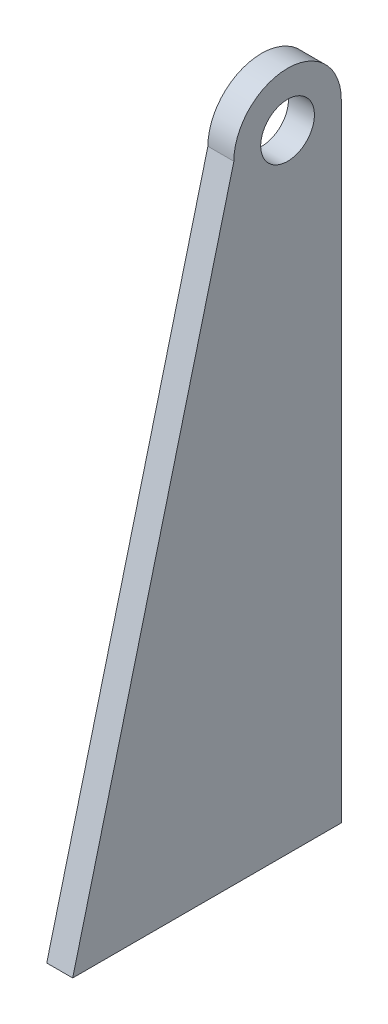
from build123d import *

# Parameters (mm, degrees)
SKETCH1_R           = 6
BOSS_EXTRUDE1_DEPTH = 5.8


with BuildPart() as part:
    # Sketch1 → Boss-Extrude1 (new body)
    with BuildSketch(Plane(origin=(0, 0, 0), x_dir=(0, 0, -1), z_dir=(1, 0, 0))):
        with BuildLine():
            Line((0, 0), (60, 0))
            Line((60, 0), (60, 140))
            ThreePointArc((60, 140), (48, 152), (36, 140))
            Line((36, 140), (0, 0))
        make_face()
        with Locations((48, 140)):
            Circle(SKETCH1_R, mode=Mode.SUBTRACT)
    extrude(amount=BOSS_EXTRUDE1_DEPTH)


solid = part.part
